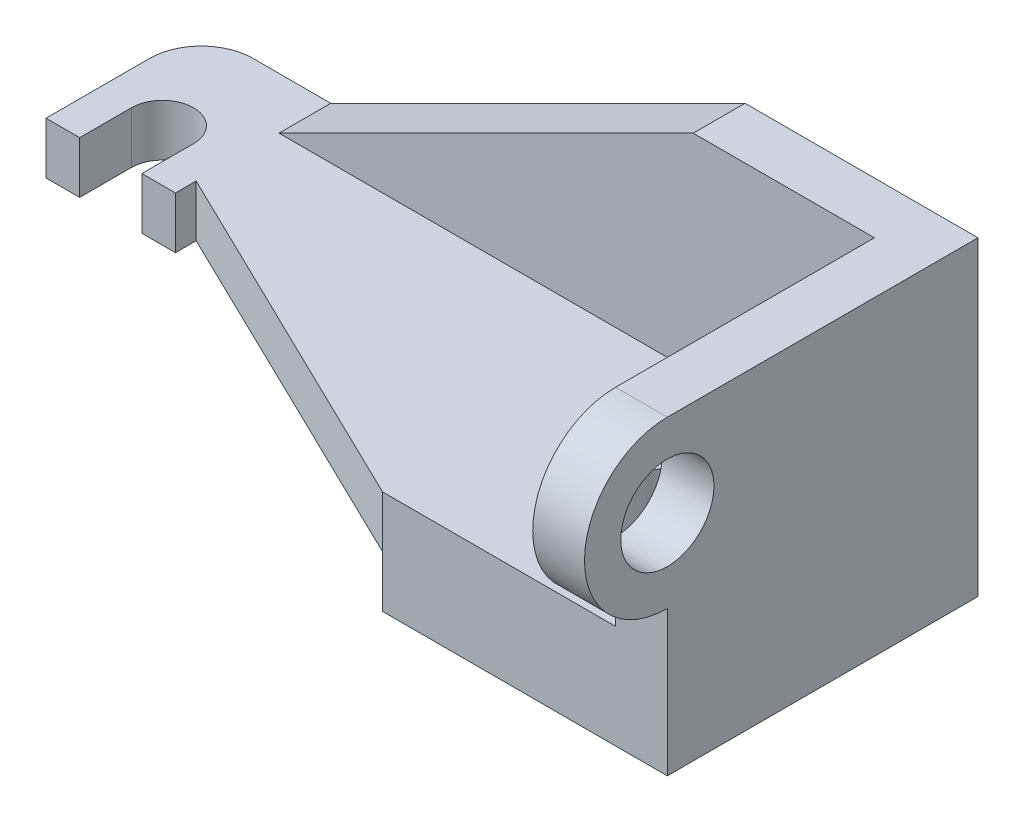
from build123d import *

# Parameters (mm, degrees)
BOSS_EXTRUDE1_DEPTH = 10
SKETCH2_R           = 9
BOSS_EXTRUDE2_DEPTH = 10
BOSS_EXTRUDE3_DEPTH = 10
SKETCH4_W           = 55
SKETCH4_H           = 60
BOSS_EXTRUDE4_DEPTH = 10
SKETCH5_R           = 9
CUT_EXTRUDE1_DEPTH  = 38


with BuildPart() as part:
    # Sketch1 → Boss-Extrude1 (new body)
    with BuildSketch(Plane(origin=(0, 0, 0), x_dir=(1, 0, 0), z_dir=(0, 1, 0))):
        with BuildLine():
            Line((0, -36.704850043), (55, -36.704850043))
            Line((55, -36.704850043), (55, 23.295149957))
            Line((55, 23.295149957), (-85, 23.295149957))
            ThreePointArc((-85, 23.295149957), (-92.071067812, 20.366217769), (-95, 13.295149957))
            Line((-95, 13.295149957), (-95, -6.704850043))
            Line((-95, -6.704850043), (-88.5, -6.704850043))
            Line((-88.5, -6.704850043), (-88.5, 3.295149957))
            ThreePointArc((-88.5, 3.295149957), (-82.5, 9.295149957), (-76.5, 3.295149957))
            Line((-76.5, 3.295149957), (-76.5, -6.704850043))
            Line((-76.5, -6.704850043), (-70, -6.704850043))
            Line((-70, -6.704850043), (-70, -2.704850043))
            Line((-70, -2.704850043), (0, -36.704850043))
        make_face()
    extrude(amount=BOSS_EXTRUDE1_DEPTH)

    # Sketch2 → Boss-Extrude2 (add)
    with BuildSketch(Plane.ZY.offset(-55)):
        with BuildLine():
            Line((-23.295149957, 10), (36.704850043, 10))
            Line((36.704850043, 10), (36.704850043, 18))
            ThreePointArc((36.704850043, 18), (52.704850043, 34), (36.704850043, 50))
            Line((36.704850043, 50), (-23.295149957, 50))
            Line((-23.295149957, 50), (-23.295149957, 10))
        make_face()
        with Locations((36.704850043, 34)):
            Circle(SKETCH2_R, mode=Mode.SUBTRACT)
    extrude(amount=BOSS_EXTRUDE2_DEPTH)

    # Sketch3 → Boss-Extrude3 (add)
    with BuildSketch(Plane.XY.offset(-23.295149957)):
        Polygon((45, 10), (-70, 10), (10, 50), (45, 50), (45, 11.165402215), align=None)
    extrude(amount=BOSS_EXTRUDE3_DEPTH)

    # Sketch4 → Boss-Extrude4 (add)
    with BuildSketch(Plane(origin=(0, 0, 0), x_dir=(-1, 0, 0), z_dir=(0, -1, 0))):
        with Locations((-27.5, -6.704850043)):
            Rectangle(SKETCH4_W, SKETCH4_H)
    extrude(amount=BOSS_EXTRUDE4_DEPTH)

    # Sketch5 → Cut-Extrude1 (cut)
    with BuildSketch(Plane(origin=(0, 10, 0), x_dir=(1, 0, 0), z_dir=(0, 1, 0))):
        with Locations(Location((30, -11.704850043, 0), (0, 0, 270))):
            Circle(SKETCH5_R)
    extrude(amount=-CUT_EXTRUDE1_DEPTH, mode=Mode.SUBTRACT)


solid = part.part
